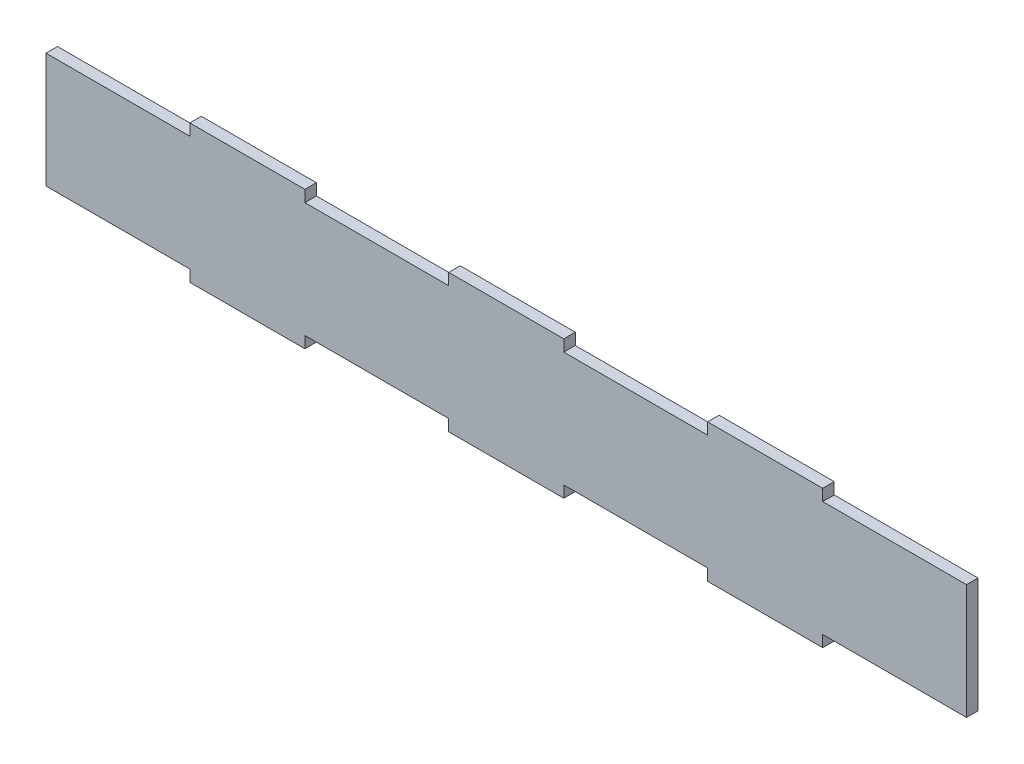
from build123d import *

# Parameters (mm, degrees)
EXTRUDE_1_DEPTH = 2


with BuildPart() as part:
    # Эскиз1 → Бобышка-Вытянуть1 (new body)
    with BuildSketch(Plane.XY):
        Polygon((25, 2), (25, 0), (45, 0), (45, 2), (70, 2), (70, 0), (90, 0), (90, 2), (115, 2), (115, 0), (135, 0), (135, 2), (160, 2), (160, 22), (135, 22), (135, 24), (115, 24), (115, 22), (90, 22), (90, 24), (70, 24), (70, 22), (45, 22), (45, 24), (25, 24), (25, 22), (0, 22), (0, 2), align=None)
    extrude(amount=EXTRUDE_1_DEPTH)


solid = part.part
